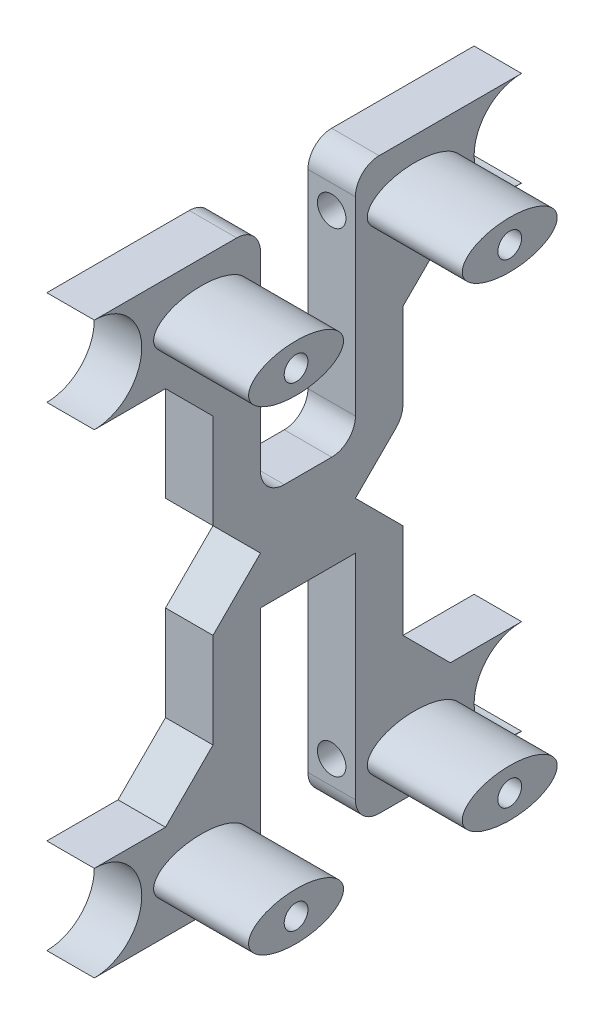
from build123d import *

# Parameters (mm, degrees)
BOSS_EXTRUDE1_DEPTH = 20
SKETCH1_4_RX        = 20
SKETCH1_4_RY        = 10
SKETCH1_4_R         = 5
BOSS_EXTRUDE2_DEPTH = 40
SKETCH2_R           = 6
CUT_EXTRUDE1_DEPTH  = 35
FILLET1_R           = 10


with BuildPart() as part:
    # Sketch1 → Boss-Extrude1 (new body)
    with BuildSketch(Plane(origin=(0, 0, 0), x_dir=(0, 0, -1), z_dir=(1, 0, 0))):
        with BuildLine():
            Line((0, 0), (0, 20))
            Line((0, 20), (20, 20))
            Line((20, 20), (20, 110))
            ThreePointArc((20, 110), (22.928932188, 117.071067812), (30, 120))
            Line((30, 120), (90, 120))
            ThreePointArc((90, 120), (70, 100), (90, 80))
            Line((90, 80), (60, 80))
            Line((60, 80), (40, 60))
            Line((40, 60), (40, 20))
            Line((40, 20), (20, 0))
            Line((20, 0), (0, 0))
        make_face()
    extrude(amount=-BOSS_EXTRUDE1_DEPTH)

    # Sketch1<4> → Boss-Extrude2 (add)
    with BuildSketch(Plane(origin=(0, 0, 0), x_dir=(0, 0, -1), z_dir=(1, 0, 0))):
        with Locations(Location((45, 100), (0, 0, 180))):
            Ellipse(SKETCH1_4_RX, SKETCH1_4_RY)
        with Locations((45, 100)):
            Circle(SKETCH1_4_R, mode=Mode.SUBTRACT)
    extrude(amount=BOSS_EXTRUDE2_DEPTH)

    # Sketch2 → Cut-Extrude1 (cut)
    with BuildSketch(Plane.XY.offset(-20)):
        with Locations((-10, 100)):
            Circle(SKETCH2_R)
    extrude(amount=-CUT_EXTRUDE1_DEPTH, mode=Mode.SUBTRACT)

    # Mirror1: part across plane


with BuildPart() as part_1:
    add(part.part)
    add(part.part.mirror(Plane(origin=(-20, 0, 0), x_dir=(1, 0, 0), z_dir=(0, 0, -1))))

    # Mirror2: part across plane


with BuildPart() as part_2:
    add(part_1.part)
    add(part_1.part.mirror(Plane(origin=(-20, 0, -20), x_dir=(0, 0, 1), z_dir=(0, 1, 0))))

    # Fillet1
    fillet1_edges = [part_2.edges().sort_by_distance(p)[0] for p in [
        (-10, 20, -40),
        (-10, 20, -20),
        (-10, 20, 20),
    ]]
    fillet(fillet1_edges, radius=FILLET1_R)


solid = part_2.part
